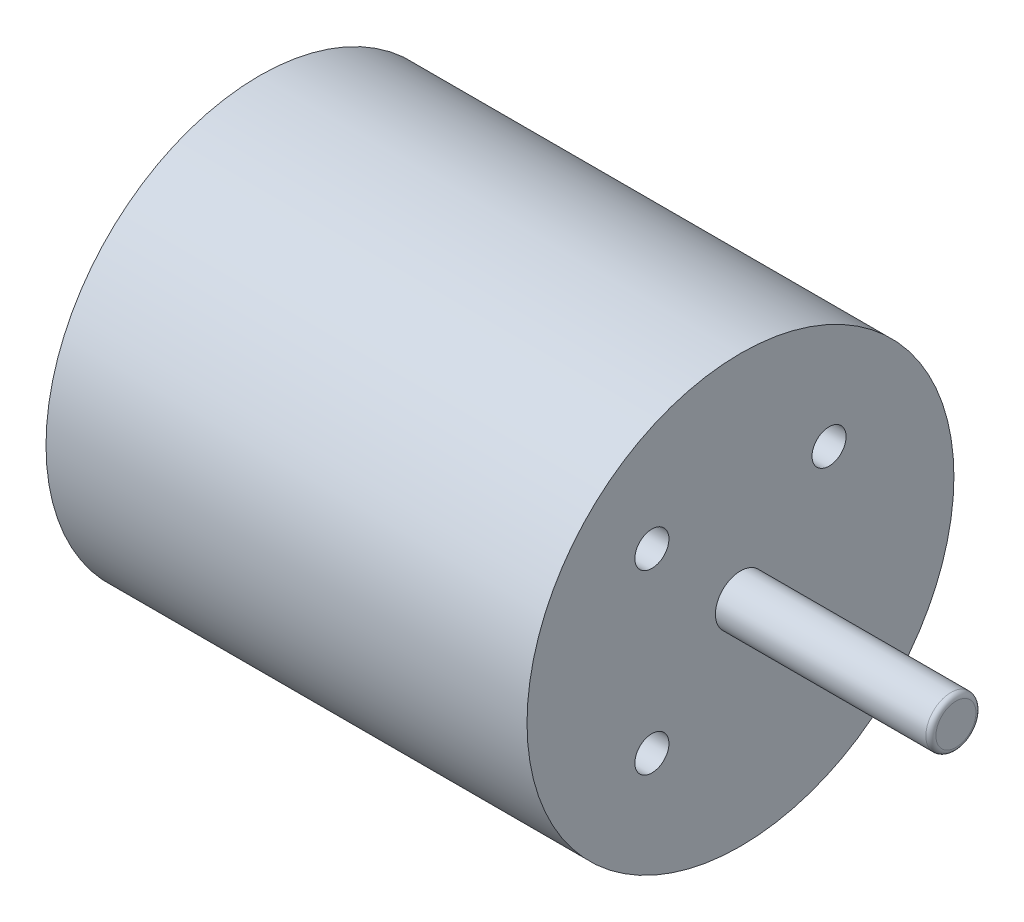
from build123d import *

# Parameters (mm, degrees)
ESBO_O1_W                        = 69.5
ESBO_O1_H                        = 2.5
FILETE1_R                        = 0.5
ESBO_O10_W                       = 48
ESBO_O10_H                       = 18.799
FURO_COM_FOLGA_DE_M32_AT_2_COUNT = 2
FURO_COM_FOLGA_DE_M32_AT_2_PITCH = 17.67766953
FURO_COM_FOLGA_DE_M32_AT_3_COUNT = 2
FURO_COM_FOLGA_DE_M32_AT_3_PITCH = 25
FURO_COM_FOLGA_DE_M32_AT_4_COUNT = 2
FURO_COM_FOLGA_DE_M32_AT_4_PITCH = 17.67766953
FURO_COM_FOLGA_DE_M33_AT_2_COUNT = 2
FURO_COM_FOLGA_DE_M33_AT_2_PITCH = 14.142135624
FURO_COM_FOLGA_DE_M33_AT_3_COUNT = 2
FURO_COM_FOLGA_DE_M33_AT_3_PITCH = 20
FURO_COM_FOLGA_DE_M33_AT_4_COUNT = 2
FURO_COM_FOLGA_DE_M33_AT_4_PITCH = 14.142135624


with BuildPart() as part:
    # Esboço1 → Revolução2 (revolve)
    with BuildSketch(Plane.XY, mode=Mode.PRIVATE) as revolu_o2_sk:
        with Locations((2.25, 1.25)):
            Rectangle(ESBO_O1_W, ESBO_O1_H)
    revolve(revolu_o2_sk.sketch.rotate(Axis((-36.840109943, 0, 0), (1, 0, 0)), 90), axis=Axis((-36.840109943, 0, 0), (1, 0, 0)))

    # Filete1
    filete1_edges = [part.edges().sort_by_distance(p)[0] for p in [
        (37, 0, -2.5),
    ]]
    fillet(filete1_edges, radius=FILETE1_R)


with BuildPart() as body_2:
    # Esboço10 → Revolução3 (revolve)
    with BuildSketch(Plane(origin=(0, 0, 0), x_dir=(1, 0, 0), z_dir=(0, 1, 0)), mode=Mode.PRIVATE) as revolu_o3_sk:
        with Locations((-8.5, -11.9005)):
            Rectangle(ESBO_O10_W, ESBO_O10_H)
    revolve(revolu_o3_sk.sketch.rotate(Axis((36.5, 0, 0), (-1, 0, 0)), 180), axis=Axis((36.5, 0, 0), (-1, 0, 0)))

    # Esboço12 → Furo com folga de M32 (revolve, cut)
    with BuildSketch(Plane(origin=(15.5, 8.838834765, 8.838834765), x_dir=(0, 0, -1), z_dir=(0, 1, 0))):
        Polygon((0, 0), (0, 11.021463052), (1.7, 10), (1.7, 0), align=None)
    furo_com_folga_de_m32 = revolve(axis=Axis((21.85, 8.838834765, 8.838834765), (-1, 0, 0)), mode=Mode.SUBTRACT)

    # Furo com folga de M32 at 2: Furo com folga de M32 ×2
    with Locations(*[(0, 0, -i * FURO_COM_FOLGA_DE_M32_AT_2_PITCH) for i in range(1, FURO_COM_FOLGA_DE_M32_AT_2_COUNT)]):
        add(furo_com_folga_de_m32, mode=Mode.SUBTRACT)

    # Furo com folga de M32 at 3: Furo com folga de M32 ×2
    with Locations(*[Vector(0, -0.7071067811865437, -0.7071067811865515) * (i * FURO_COM_FOLGA_DE_M32_AT_3_PITCH) for i in range(1, FURO_COM_FOLGA_DE_M32_AT_3_COUNT)]):
        add(furo_com_folga_de_m32, mode=Mode.SUBTRACT)

    # Furo com folga de M32 at 4: Furo com folga de M32 ×2
    with Locations(*[(0, -i * FURO_COM_FOLGA_DE_M32_AT_4_PITCH, 0) for i in range(1, FURO_COM_FOLGA_DE_M32_AT_4_COUNT)]):
        add(furo_com_folga_de_m32, mode=Mode.SUBTRACT)

    # Esboço15 → Furo com folga de M33 (revolve, cut)
    with BuildSketch(Plane(origin=(-32.5, 7.071067812, -7.071067812), x_dir=(0, 0, 1), z_dir=(0, 1, 0))):
        Polygon((0, 0), (0, 11.021463052), (1.7, 10), (1.7, 0), align=None)
    furo_com_folga_de_m33 = revolve(axis=Axis((-38.85, 7.071067812, -7.071067812), (1, 0, 0)), mode=Mode.SUBTRACT)

    # Furo com folga de M33 at 2: Furo com folga de M33 ×2
    with Locations(*[(0, -i * FURO_COM_FOLGA_DE_M33_AT_2_PITCH, 0) for i in range(1, FURO_COM_FOLGA_DE_M33_AT_2_COUNT)]):
        add(furo_com_folga_de_m33, mode=Mode.SUBTRACT)

    # Furo com folga de M33 at 3: Furo com folga de M33 ×2
    with Locations(*[Vector(0, -0.7071067811865432, 0.7071067811865519) * (i * FURO_COM_FOLGA_DE_M33_AT_3_PITCH) for i in range(1, FURO_COM_FOLGA_DE_M33_AT_3_COUNT)]):
        add(furo_com_folga_de_m33, mode=Mode.SUBTRACT)

    # Furo com folga de M33 at 4: Furo com folga de M33 ×2
    with Locations(*[(0, 0, i * FURO_COM_FOLGA_DE_M33_AT_4_PITCH) for i in range(1, FURO_COM_FOLGA_DE_M33_AT_4_COUNT)]):
        add(furo_com_folga_de_m33, mode=Mode.SUBTRACT)


solid = Compound([part.part, body_2.part])
